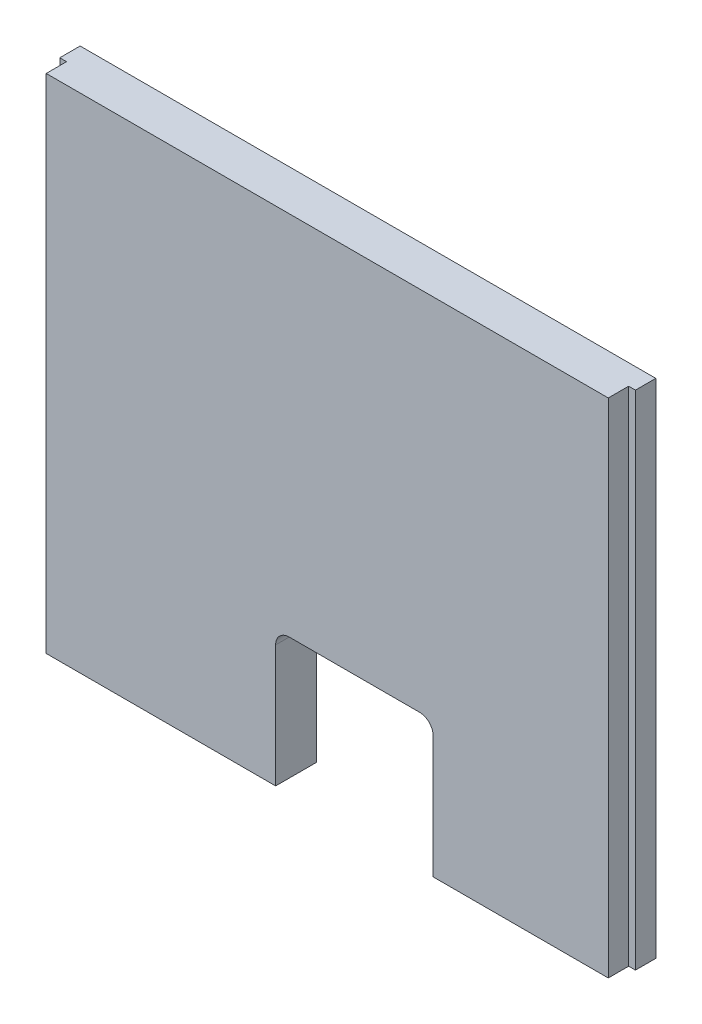
from build123d import *

# Parameters (mm, degrees)
SKETCH1_W           = 42.4
SKETCH1_H           = 37
BOSS_EXTRUDE1_DEPTH = 1.5
SKETCH2_W           = 41.4
SKETCH2_H           = 37
BOSS_EXTRUDE2_DEPTH = 1.5
SKETCH3_W           = 11.6
SKETCH3_H           = 10
CUT_EXTRUDE1_DEPTH  = 29.29646621
FILLET1_R           = 1


with BuildPart() as part:
    # Sketch1 → Boss-Extrude1 (new body)
    with BuildSketch(Plane.XY):
        Rectangle(SKETCH1_W, SKETCH1_H)
    extrude(amount=BOSS_EXTRUDE1_DEPTH)

    # Sketch2 → Boss-Extrude2 (add)
    with BuildSketch(Plane.XY.offset(1.5)):
        Rectangle(SKETCH2_W, SKETCH2_H)
    extrude(amount=BOSS_EXTRUDE2_DEPTH)

    # Sketch3 → Cut-Extrude1 (cut, through all)
    with BuildSketch(Plane(origin=(0, 0, 0), x_dir=(-1, 0, 0), z_dir=(0, 0, -1))):
        with Locations((-2, -13.5)):
            Rectangle(SKETCH3_W, SKETCH3_H)
    extrude(amount=-CUT_EXTRUDE1_DEPTH, mode=Mode.SUBTRACT)

    # Fillet1
    fillet1_edges = [part.edges().sort_by_distance(p)[0] for p in [
        (7.8, -8.5, 1.5),
        (-3.8, -8.5, 1.5),
    ]]
    fillet(fillet1_edges, radius=FILLET1_R)


solid = part.part
